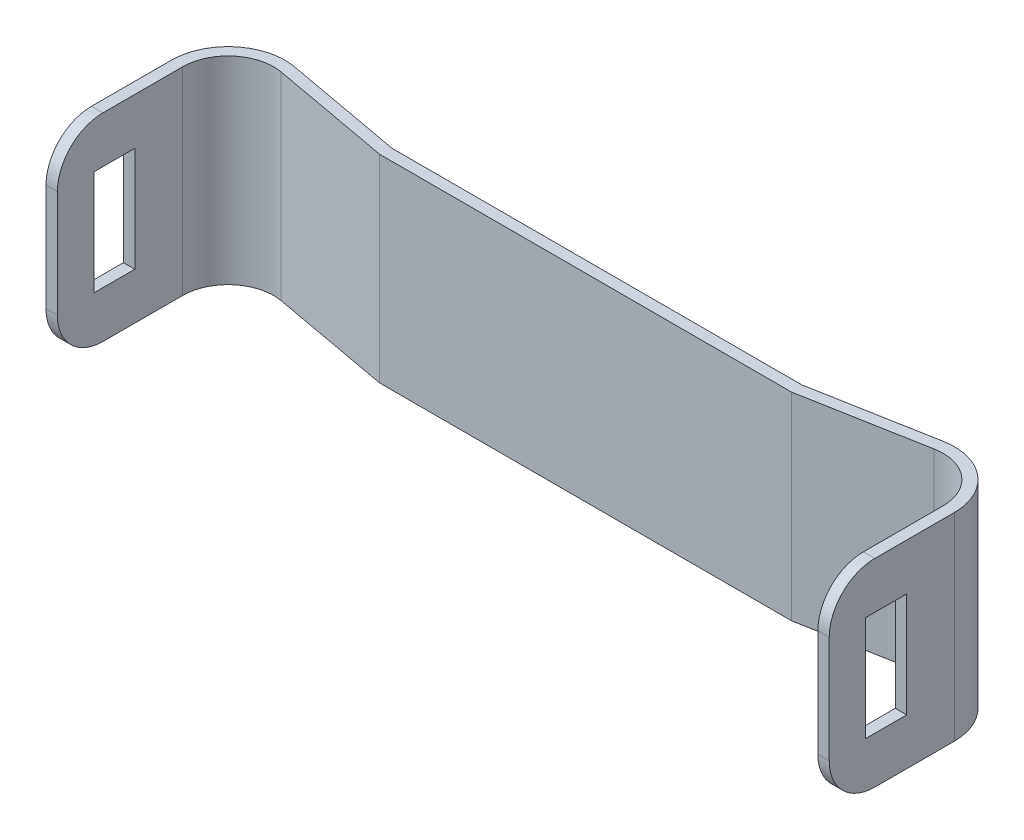
from build123d import *

# Parameters (mm, degrees)
BASE_EXTRUDE_THIN_DEPTH = 4.35
SKETCH2_W               = 1.8
SKETCH2_H               = 4.6
CUT_EXTRUDE1_DEPTH      = 36.373471698


with BuildPart() as part:
    # Sketch1 → Base-Extrude-Thin (new, symmetric)
    with BuildSketch(Plane(origin=(0, 0, 0), x_dir=(1, 0, 0), z_dir=(0, 1, 0))):
        with BuildLine():
            Line((-17.2, -7), (-17.2, -1.5))
            ThreePointArc((-17.2, -1.5), (-16.30105087, 0.420061486), (-14.250691112, 0.959292891))
            Line((-14.250691112, 0.959292891), (-9, 0))
            Line((-9, 0), (9, 0))
            Line((9, 0), (14.250691112, 0.959292891))
            ThreePointArc((14.250691112, 0.959292891), (16.30105087, 0.420061486), (17.2, -1.5))
            Line((17.2, -1.5), (17.2, -7))
            Line((17.2, -7), (16.7, -7))
            Line((16.7, -7), (16.7, -1.5))
            ThreePointArc((16.7, -1.5), (15.980840696, 0.036049189), (14.340552889, 0.467434313))
            Line((14.340552889, 0.467434313), (9.045299693, -0.5))
            Line((9.045299693, -0.5), (-9.045299693, -0.5))
            Line((-9.045299693, -0.5), (-14.340552889, 0.467434313))
            ThreePointArc((-14.340552889, 0.467434313), (-15.980840696, 0.036049189), (-16.7, -1.5))
            Line((-16.7, -1.5), (-16.7, -7))
            Line((-16.7, -7), (-17.2, -7))
        make_face()
    extrude(amount=BASE_EXTRUDE_THIN_DEPTH, both=True)

    # Sketch2 → Cut-Extrude1 (cut, through all)
    with BuildSketch(Plane(origin=(17.2, 0, 0), x_dir=(0, 0, -1), z_dir=(1, 0, 0))):
        with Locations((-4.5, 0)):
            Rectangle(SKETCH2_W, SKETCH2_H)
        with BuildLine():
            Line((-7, 2.35), (-7, -2.35))
            ThreePointArc((-7, -2.35), (-6.414213562, -3.764213562), (-5, -4.35))
            Line((-5, -4.35), (-5, -8))
            Line((-5, -8), (-10, -8))
            Line((-10, -8), (-10, 8))
            Line((-10, 8), (-5, 8))
            Line((-5, 8), (-5, 4.35))
            ThreePointArc((-5, 4.35), (-6.414213562, 3.764213562), (-7, 2.35))
        make_face()
    extrude(amount=-CUT_EXTRUDE1_DEPTH, mode=Mode.SUBTRACT)


solid = part.part
